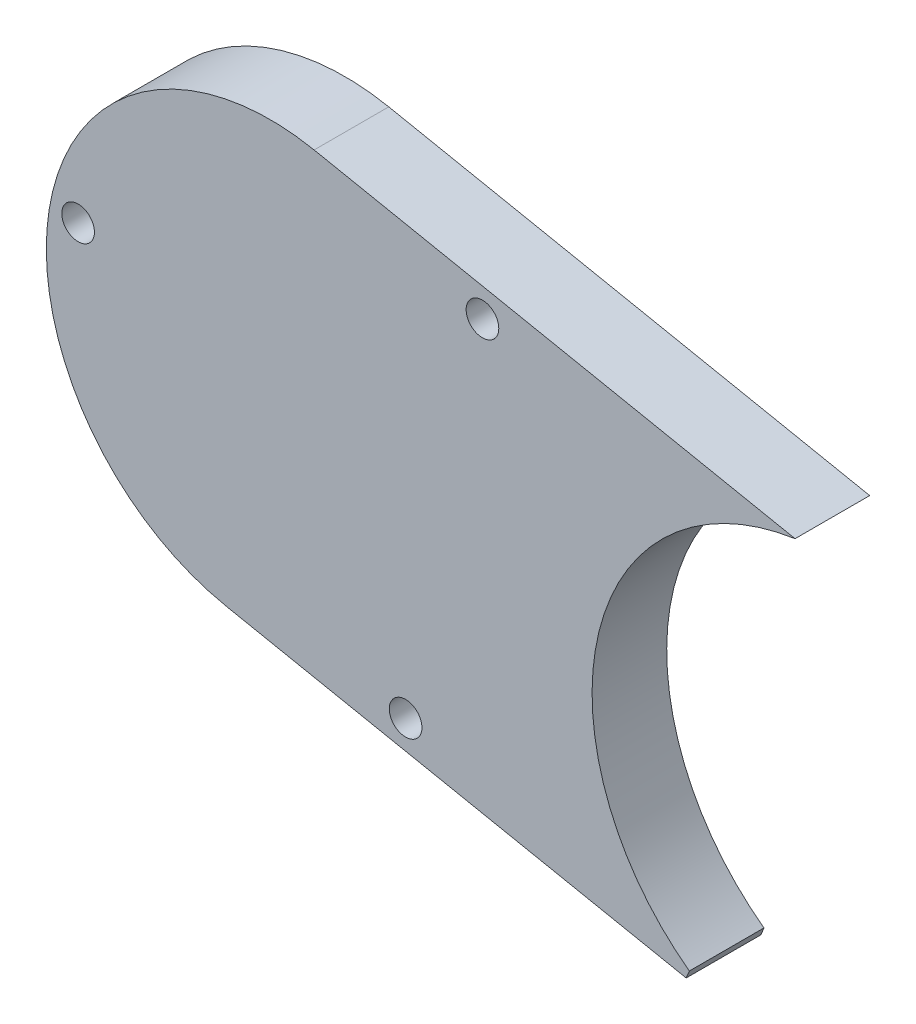
from build123d import *

# Parameters (mm, degrees)
SKETCH1_R           = 0.875
BOSS_EXTRUDE1_DEPTH = 4
CUT_EXTRUDE1_DEPTH  = 10


with BuildPart() as part:
    # Sketch1 → Boss-Extrude1 (new body)
    with BuildSketch(Plane.XY):
        with BuildLine():
            Line((-27.646606378, 17.766968108), (-1.871361719, 12.611919177))
            ThreePointArc((-1.871361719, 12.611919177), (-12.502403615, 2.500480723), (-6.578148963, -10.92201704))
            Line((-6.578148963, -10.92201704), (-32.353393622, -5.766968108))
            ThreePointArc((-32.353393622, -5.766968108), (-41.766968108, 8.353393622), (-27.646606378, 17.766968108))
        make_face()
        with Locations((-40.296097095, 8.059219419)):
            Circle(SKETCH1_R, mode=Mode.SUBTRACT)
        with Locations((-18.625264162, 14.432993811)):
            Circle(SKETCH1_R, mode=Mode.SUBTRACT)
        with Locations((-22.743703, -6.159200379)):
            Circle(SKETCH1_R, mode=Mode.SUBTRACT)
    extrude(amount=BOSS_EXTRUDE1_DEPTH)

    # Sketch2 → Cut-Extrude1 (cut)
    with BuildSketch(Plane(origin=(0, 0, 0), x_dir=(-1, 0, 0), z_dir=(0, 0, -1))):
        Polygon((7.192307692, -9.461538462), (7.961538462, -11.307692308), (6.115384615, -12.076923077), (5.346153846, -10.230769231), align=None)
    extrude(amount=-CUT_EXTRUDE1_DEPTH, mode=Mode.SUBTRACT)


solid = part.part
